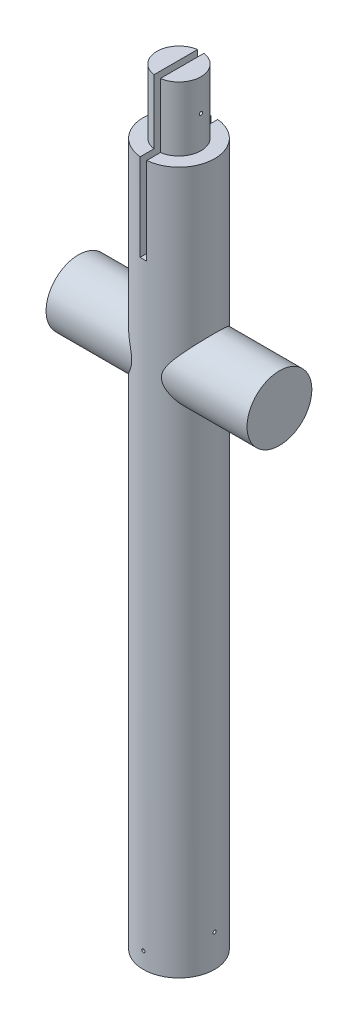
from build123d import *

# Parameters (mm, degrees)
SKETCH1_R               = 11
BOSS_EXTRUDE1_DEPTH     = 216.66667
BOSS_EXTRUDE2_START     = 216.66667
SKETCH2_R               = 6.8
BOSS_EXTRUDE2_DEPTH     = 19.8
CUT_EXTRUDE2_START      = -1.4
SKETCH4_R               = 0.5
CUT_EXTRUDE2_DEPTH      = 9
SKETCH6_R               = 7
CUT_EXTRUDE3_DEPTH      = 20
CUT_EXTRUDE4_DEPTH      = 237.977817671
CUT_EXTRUDE4_DEPTH_BACK = 237.977817671
SKETCH7_R               = 0.5
CUT_EXTRUDE5_DEPTH      = 237.97781768
CUT_EXTRUDE5_DEPTH_BACK = 237.97781768
SKETCH10_R              = 0.5
CUT_EXTRUDE6_DEPTH      = 237.97781768
CUT_EXTRUDE6_DEPTH_BACK = 237.97781768
SKETCH11_W              = 2
SKETCH11_H              = 46.680194511
BOSS_EXTRUDE3_START     = 2.5
SKETCH14_R              = 10
BOSS_EXTRUDE3_DEPTH     = 28.5


with BuildPart() as part:
    # Sketch1 → Boss-Extrude1 (new body)
    with BuildSketch(Plane(origin=(0, 0, 0), x_dir=(1, 0, 0), z_dir=(0, 1, 0))):
        with Locations(Location((0, 0, 0), (0, 0, 270))):
            Circle(SKETCH1_R)
    extrude(amount=BOSS_EXTRUDE1_DEPTH)

    # Sketch2 → Boss-Extrude2 (add)
    with BuildSketch(Plane(origin=(0, 0, 0), x_dir=(1, 0, 0), z_dir=(0, 1, 0)).offset(BOSS_EXTRUDE2_START)):
        with Locations(Location((0, 0, 0), (0, 0, 90))):
            Circle(SKETCH2_R)
    extrude(amount=BOSS_EXTRUDE2_DEPTH)

    # Sketch4 → Cut-Extrude2 (cut)
    with BuildSketch(Plane(origin=(0, 0, 0), x_dir=(0, 0, -1), z_dir=(1, 0, 0)).offset(CUT_EXTRUDE2_START)):
        with Locations((0, 226.66667)):
            Circle(SKETCH4_R)
    cut_extrude2 = extrude(amount=-CUT_EXTRUDE2_DEPTH, mode=Mode.SUBTRACT)

    # Mirror2: Cut-Extrude2 across plane
    add(cut_extrude2.mirror(Plane(origin=(0, 0, 0), x_dir=(0, 0, 1), z_dir=(1, 0, 0))), mode=Mode.SUBTRACT)

    # Sketch6 → Cut-Extrude3 (cut)
    with BuildSketch(Plane(origin=(0, 0, 0), x_dir=(1, 0, 0), z_dir=(0, 1, 0))):
        with Locations(Location((0, 0, 0), (0, 0, 270))):
            Circle(SKETCH6_R)
    extrude(amount=CUT_EXTRUDE3_DEPTH, mode=Mode.SUBTRACT)

    # Sketch7 → Cut-Extrude4 (cut, two sides: drawn at the far end of the back side and taken through both)
    with BuildSketch(Plane(origin=(0, 0, 0), x_dir=(0, 0, -1), z_dir=(1, 0, 0)).offset(-CUT_EXTRUDE4_DEPTH_BACK)):
        with Locations((0, 10)):
            Circle(SKETCH7_R)
    extrude(amount=CUT_EXTRUDE4_DEPTH + CUT_EXTRUDE4_DEPTH_BACK, mode=Mode.SUBTRACT)

    # Sketch10 → Cut-Extrude5 (cut, two sides: drawn at the far end of the back side and taken through both)
    with BuildSketch(Plane.XY.offset(-CUT_EXTRUDE5_DEPTH_BACK)):
        with Locations((0, 5)):
            Circle(SKETCH10_R)
    extrude(amount=CUT_EXTRUDE5_DEPTH + CUT_EXTRUDE5_DEPTH_BACK, mode=Mode.SUBTRACT)

    # Sketch11 → Cut-Extrude6 (cut, two sides: drawn at the far end of the back side and taken through both)
    with BuildSketch(Plane.XY.offset(-CUT_EXTRUDE6_DEPTH_BACK)):
        with Locations((0, 213.126572745)):
            Rectangle(SKETCH11_W, SKETCH11_H)
    extrude(amount=CUT_EXTRUDE6_DEPTH + CUT_EXTRUDE6_DEPTH_BACK, mode=Mode.SUBTRACT)

    # Sketch14 → Boss-Extrude3 (add)
    with BuildSketch(Plane(origin=(0, 0, 0), x_dir=(0, 0, -1), z_dir=(1, 0, 0)).offset(BOSS_EXTRUDE3_START)):
        with Locations(Location((0, 160, 0), (0, 0, 180))):
            Circle(SKETCH14_R)
    boss_extrude3 = extrude(amount=BOSS_EXTRUDE3_DEPTH)

    # Mirror3: Boss-Extrude3 across plane
    add(boss_extrude3.mirror(Plane(origin=(0, 0, 0), x_dir=(0, 0, 1), z_dir=(1, 0, 0))))


solid = part.part
